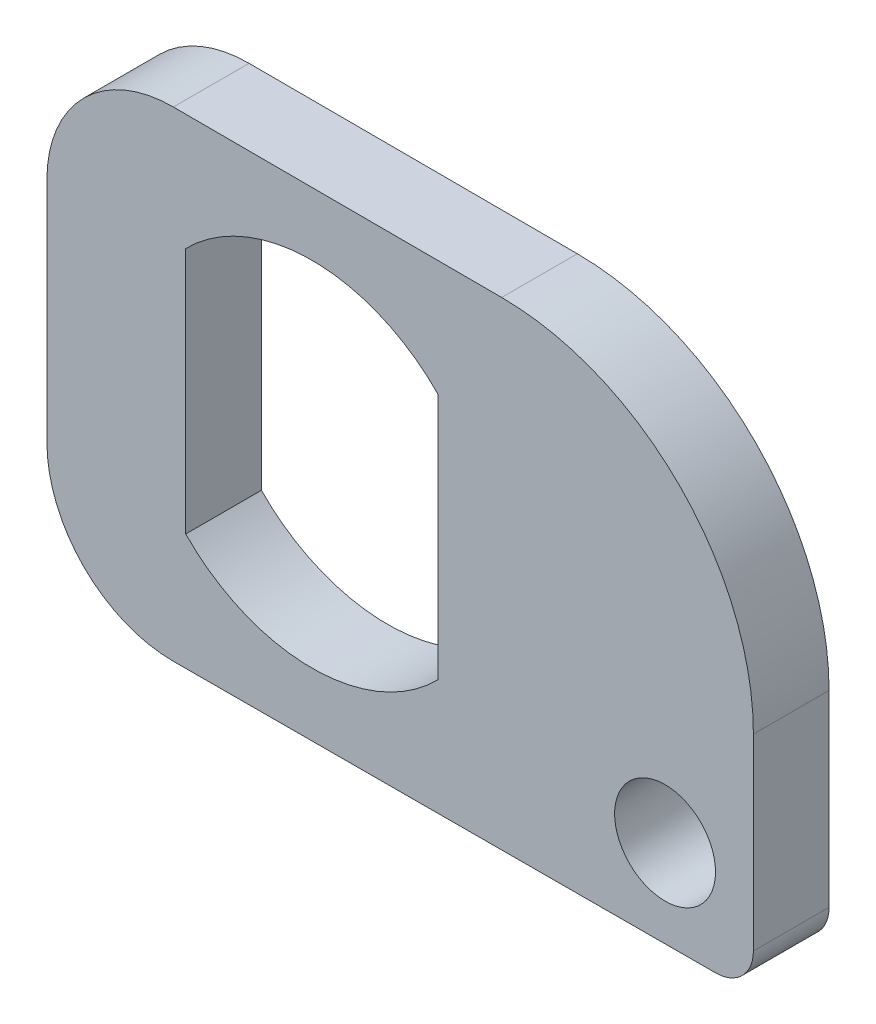
from build123d import *

# Parameters (mm, degrees)
SKETCH1_R           = 4
BOSS_EXTRUDE1_DEPTH = 6


with BuildPart() as part:
    # Sketch1 → Boss-Extrude1 (new body)
    with BuildSketch(Plane.XY):
        with BuildLine():
            Line((32.00713516, -18.923928181), (-10.976216134, -19.026159499))
            ThreePointArc((-10.976216134, -19.026159499), (-18.062653939, -16.105659467), (-21, -9.026187783))
            Line((-21, -9.026187783), (-21, 9.026187783))
            ThreePointArc((-21, 9.026187783), (-18.062653939, 16.105659467), (-10.976216134, 19.026159499))
            Line((-10.976216134, 19.026159499), (15.047567733, 18.964264704))
            ThreePointArc((15.047567733, 18.964264704), (29.158943369, 13.08962915), (35, -1.035678729))
            Line((35, -1.035678729), (35, -15.923936666))
            ThreePointArc((35, -15.923936666), (34.123841505, -18.042732848), (32.00713516, -18.923928181))
        make_face()
        with Locations((28, -12)):
            Circle(SKETCH1_R, mode=Mode.SUBTRACT)
        with BuildLine():
            Line((-10, 9.797958971), (-10, -9.797958971))
            ThreePointArc((-10, -9.797958971), (0, -14), (10, -9.797958971))
            Line((10, -9.797958971), (10, 9.797958971))
            ThreePointArc((10, 9.797958971), (0, 14), (-10, 9.797958971))
        make_face(mode=Mode.SUBTRACT)
    extrude(amount=BOSS_EXTRUDE1_DEPTH)


solid = part.part
